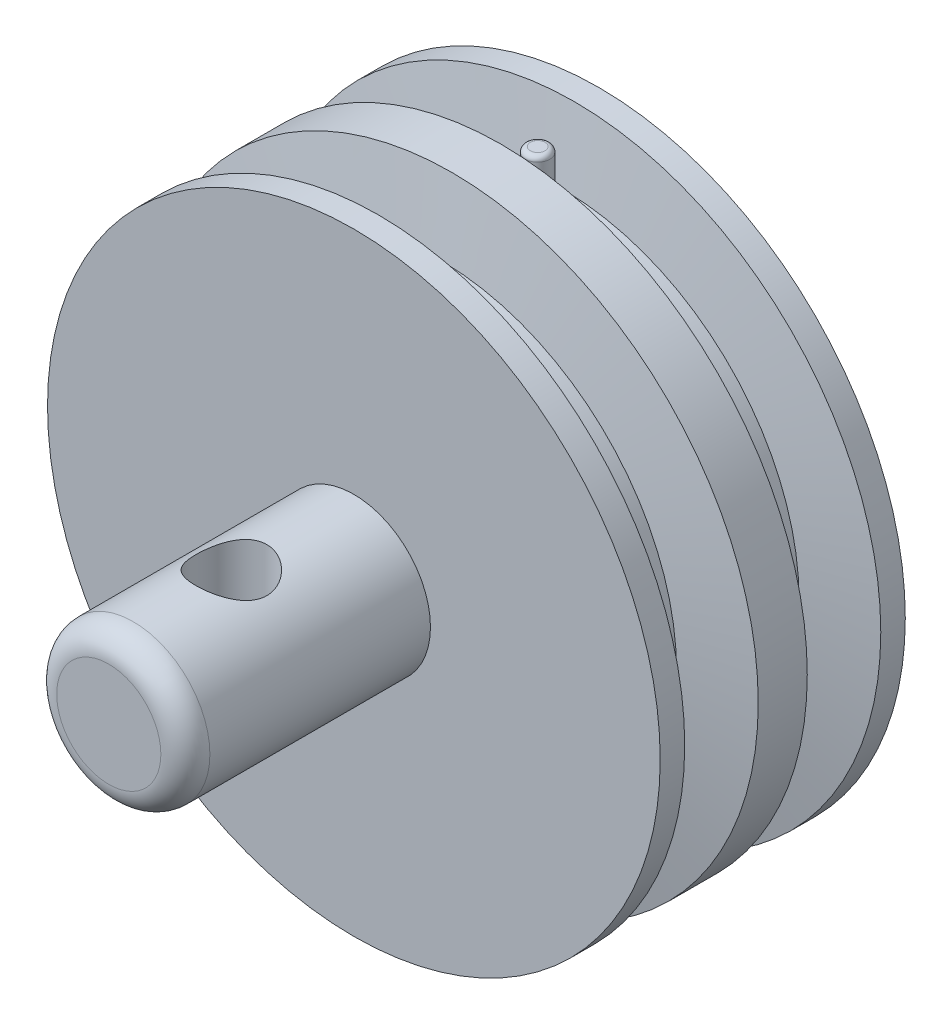
from build123d import *

# Parameters (mm, degrees)
ESQUISSE1_R                  = 3.125
BOSS_EXTRU_1_DEPTH           = 10
CONG_1_R                     = 1
ESQUISSE2_R                  = 12.5
BOSS_EXTRU_3_DEPTH           = 10
ENL_V_MAT_EXTRU_1_DEPTH      = 21.310096012
ENL_V_MAT_EXTRU_1_DEPTH_BACK = 21.310096012
ESQUISSE6_R                  = 1.45
BOSS_EXTRU_4_DEPTH           = 2
BOSS_EXTRU_4_DEPTH_BACK      = 1
ESQUISSE7_R                  = 0.5
BOSS_EXTRU_5_DEPTH           = 2
BOSS_EXTRU_5_DEPTH_BACK      = 1
ESQUISSE8_R                  = 0.5
CONG_2_R                     = 0.2


with BuildPart() as part:
    # Esquisse1 → Boss.-Extru.1 (new body)
    with BuildSketch(Plane.XY):
        Circle(ESQUISSE1_R)
    extrude(amount=BOSS_EXTRU_1_DEPTH)

    # Congé1
    cong_1_edges = [part.edges().sort_by_distance(p)[0] for p in [
        (-3.125, 0, 10),
    ]]
    fillet(cong_1_edges, radius=CONG_1_R)

    # Esquisse2 → Boss.-Extru.3 (add)
    with BuildSketch(Plane(origin=(0, 0, 0), x_dir=(-1, 0, 0), z_dir=(0, 0, -1))):
        Circle(ESQUISSE2_R)
    extrude(amount=BOSS_EXTRU_3_DEPTH)

    # Esquisse5 → Enlèvement de matière-Révolution1 (revolve, cut)
    with BuildSketch(Plane(origin=(0, 0, 0), x_dir=(0, 0, -1), z_dir=(1, 0, 0)), mode=Mode.PRIVATE) as enl_vement_de_mati_re_r_volution1_sk:
        Polygon((1, 12.5), (1.5, 9.66435909), (3.5, 9.66435909), (4, 12.5), align=None)
        Polygon((6, 12.5), (9, 12.5), (8.5, 9.66435909), (6.5, 9.66435909), align=None)
    revolve(enl_vement_de_mati_re_r_volution1_sk.sketch.rotate(Axis((0, 0, 0), (0, 0, -1)), 90), axis=Axis((0, 0, 0), (0, 0, -1)), mode=Mode.SUBTRACT)

    # Esquisse6 → Enlèv. mat.-Extru.1 (cut, two sides: drawn at the far end of the back side and taken through both)
    with BuildSketch(Plane(origin=(0, 0, 0), x_dir=(1, 0, 0), z_dir=(0, 1, 0)).offset(-ENL_V_MAT_EXTRU_1_DEPTH_BACK)):
        with Locations(Location((0, -5, 0), (0, 0, 270))):
            Circle(ESQUISSE6_R)
    extrude(amount=ENL_V_MAT_EXTRU_1_DEPTH + ENL_V_MAT_EXTRU_1_DEPTH_BACK, mode=Mode.SUBTRACT)

    # Esquisse7 → Boss.-Extru.4 (add, two sides: drawn at the far end of the back side and taken through both)
    with BuildSketch(Plane(origin=(0, 9.66435909, 0), x_dir=(1, 0, 0), z_dir=(0, 1, 0)).offset(-BOSS_EXTRU_4_DEPTH_BACK)):
        with Locations(Location((0, 7.5, 0), (0, 0, 270))):
            Circle(ESQUISSE7_R)
    extrude(amount=BOSS_EXTRU_4_DEPTH + BOSS_EXTRU_4_DEPTH_BACK)

    # Esquisse8 → Boss.-Extru.5 (add, two sides: drawn at the far end of the back side and taken through both)
    with BuildSketch(Plane(origin=(0, -9.66435909, 0), x_dir=(-1, 0, 0), z_dir=(0, -1, 0)).offset(-BOSS_EXTRU_5_DEPTH_BACK)):
        with Locations(Location((0, 2.5, 0), (0, 0, 90))):
            Circle(ESQUISSE8_R)
    extrude(amount=BOSS_EXTRU_5_DEPTH + BOSS_EXTRU_5_DEPTH_BACK)

    # Congé2
    cong_2_edges = [part.edges().sort_by_distance(p)[0] for p in [
        (0, 11.66435909, -8),
        (0, -11.66435909, -2),
    ]]
    fillet(cong_2_edges, radius=CONG_2_R)


solid = part.part
